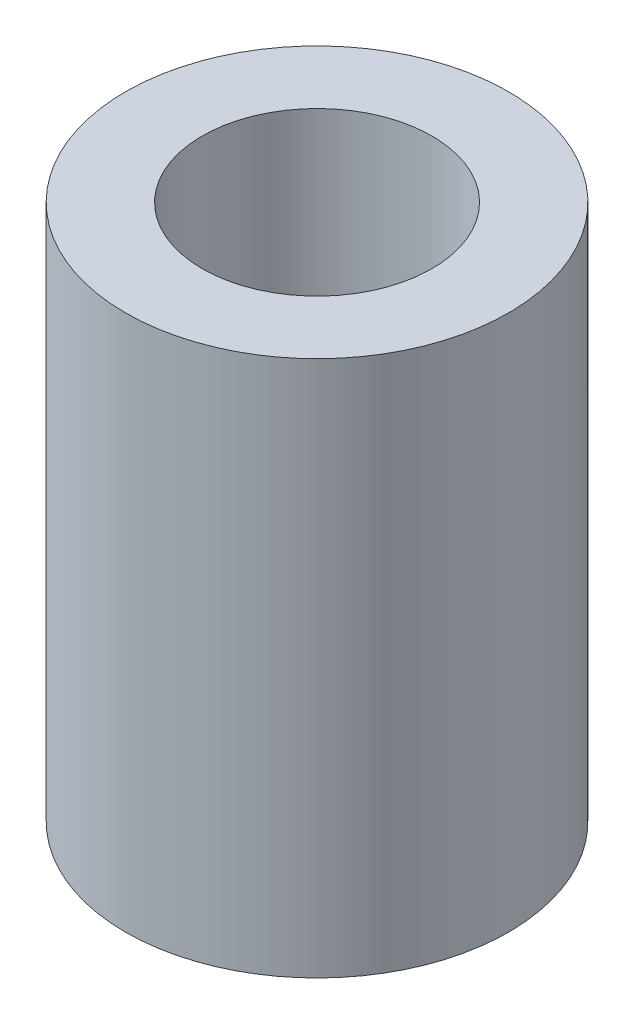
from build123d import *

# Parameters (mm, degrees)
SKETCH_1_R      = 2.5
SKETCH_1_R_2    = 1.5
EXTRUDE_1_DEPTH = 7


with BuildPart() as part:
    # 草图1 → 凸台-拉伸1 (new body)
    with BuildSketch(Plane(origin=(0, 0, 0), x_dir=(1, 0, 0), z_dir=(0, 1, 0))):
        with Locations(Location((0, 0, 0), (0, 0, 270))):
            Circle(SKETCH_1_R)
        with Locations(Location((0, 0, 0), (0, 0, 270))):
            Circle(SKETCH_1_R_2, mode=Mode.SUBTRACT)
    extrude(amount=EXTRUDE_1_DEPTH)


solid = part.part
